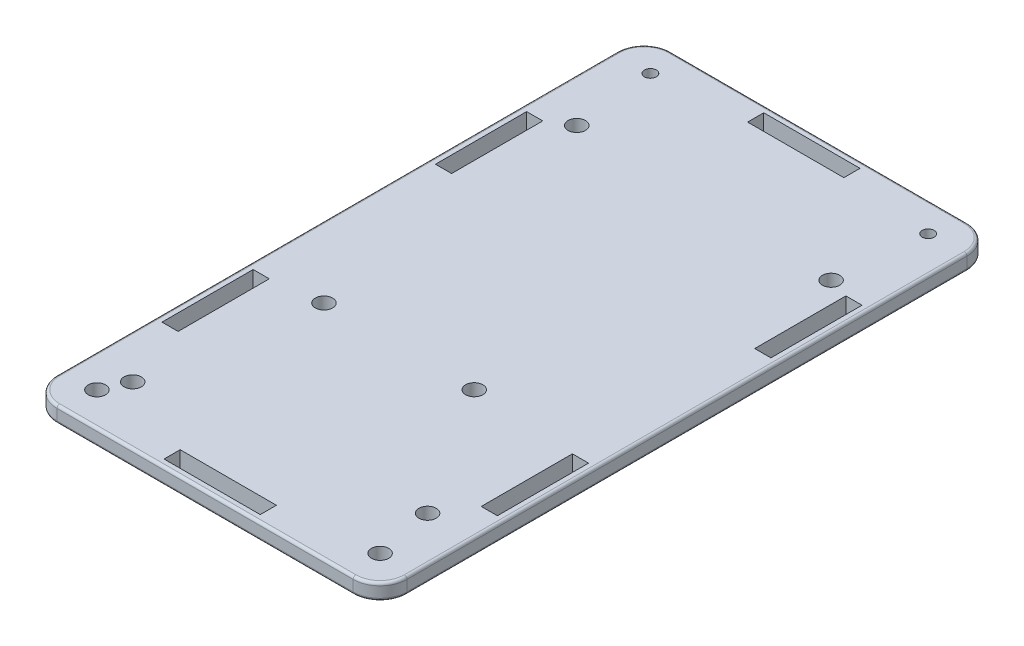
from build123d import *

# Parameters (mm, degrees)
BOSS_EXTRUDE3_DEPTH       = 3
SKETCH2_R                 = 1.608
CUT_EXTRUDE3_DEPTH        = 3
SKETCH7_R                 = 1.608
CUT_EXTRUDE8_DEPTH        = 3
SKETCH8_R                 = 1.608
CUT_EXTRUDE9_DEPTH        = 3
SKETCH9_R                 = 1.608
CUT_EXTRUDE11_DEPTH       = 3
SKETCH10_W                = 17.87
SKETCH10_H                = 3
SKETCH10_W_2              = 3
SKETCH10_H_2              = 16.933
CUT_EXTRUDE14_DEPTH       = 3
MIRROR4_COPY_1_SKETCH_W   = 17.87
MIRROR4_COPY_1_SKETCH_H   = 3
MIRROR4_COPY_1_SKETCH_W_2 = 3
MIRROR4_COPY_1_SKETCH_H_2 = 16.933
MIRROR4_COPY_1_DEPTH      = 3
SKETCH11_R                = 1.608
CUT_EXTRUDE15_DEPTH       = 3
FILLET1_R                 = 0.5
FILLET2_R                 = 0.5
SKETCH12_R                = 1.108
CUT_EXTRUDE16_DEPTH       = 3


with BuildPart() as part:
    # Sketch1 → Boss-Extrude3 (new body)
    with BuildSketch(Plane(origin=(0, 0, 0), x_dir=(1, 0, 0), z_dir=(0, 1, 0))):
        with BuildLine():
            Line((-32.5, -47), (-32.5, -52))
            ThreePointArc((-32.5, -52), (-31.035533906, -55.535533906), (-27.5, -57))
            Line((-27.5, -57), (-22.5, -57))
            Line((-22.5, -57), (22.5, -57))
            Line((22.5, -57), (27.5, -57))
            ThreePointArc((27.5, -57), (31.035533906, -55.535533906), (32.5, -52))
            Line((32.5, -52), (32.5, -47))
            Line((32.5, -47), (32.5, 47))
            Line((32.5, 47), (32.5, 52))
            ThreePointArc((32.5, 52), (31.035533906, 55.535533906), (27.5, 57))
            Line((27.5, 57), (22.5, 57))
            Line((22.5, 57), (-22.5, 57))
            Line((-22.5, 57), (-27.5, 57))
            ThreePointArc((-27.5, 57), (-31.035533906, 55.535533906), (-32.5, 52))
            Line((-32.5, 52), (-32.5, 47))
            Line((-32.5, 47), (-32.5, -47))
        make_face()
    extrude(amount=BOSS_EXTRUDE3_DEPTH)

    # Sketch2 → Cut-Extrude3 (cut)
    with BuildSketch(Plane(origin=(0, 3, 0), x_dir=(1, 0, 0), z_dir=(0, 1, 0))):
        with Locations(Location((24.261, 35.015, 0), (0, 0, 270))):
            Circle(SKETCH2_R)
    extrude(amount=-CUT_EXTRUDE3_DEPTH, mode=Mode.SUBTRACT)

    # Sketch7 → Cut-Extrude8 (cut)
    with BuildSketch(Plane.XZ):
        with Locations(Location((24.261, 39.945, 0), (0, 0, 270))):
            Circle(SKETCH7_R)
    extrude(amount=-CUT_EXTRUDE8_DEPTH, mode=Mode.SUBTRACT)

    # Sketch8 → Cut-Extrude9 (cut)
    with BuildSketch(Plane.XZ):
        with Locations(Location((-24.261, -36.285, 0), (0, 0, 270))):
            Circle(SKETCH8_R)
    extrude(amount=-CUT_EXTRUDE9_DEPTH, mode=Mode.SUBTRACT)

    # Sketch9 → Cut-Extrude11 (cut)
    with BuildSketch(Plane.XZ):
        with Locations(Location((-19.183, 15.745, 0), (0, 0, 270))):
            Circle(SKETCH9_R)
        with Locations(Location((8.725999982, 15.746, 0), (0, 0, 270))):
            Circle(SKETCH9_R)
        with Locations(Location((-24.261, 46.193, 0), (0, 0, 270))):
            Circle(SKETCH9_R)
    extrude(amount=-CUT_EXTRUDE11_DEPTH, mode=Mode.SUBTRACT)

    # Sketch10 → Cut-Extrude14 (cut)
    with BuildSketch(Plane(origin=(0, 3, 0), x_dir=(1, 0, 0), z_dir=(0, 1, 0))):
        with Locations((-0.005, -54.2)):
            Rectangle(SKETCH10_W, SKETCH10_H)
        with Locations((29.65, -25.3995)):
            Rectangle(SKETCH10_W_2, SKETCH10_H_2)
    cut_extrude14 = extrude(amount=-CUT_EXTRUDE14_DEPTH, mode=Mode.SUBTRACT)

    # Mirror3: Cut-Extrude14 across plane
    add(cut_extrude14.mirror(Plane.XY), mode=Mode.SUBTRACT)

    # Mirror4: Cut-Extrude14 across plane
    add(cut_extrude14.mirror(Plane(origin=(0, 0, 0), x_dir=(0, 0, 1), z_dir=(1, 0, 0))), mode=Mode.SUBTRACT)

    # Mirror4 copy 1 sketch → Mirror4 copy 1 (cut)
    with BuildSketch(Plane(origin=(0, 3, 0), x_dir=(-1, 0, 0), z_dir=(0, 1, 0))):
        with Locations((-0.005, -54.2)):
            Rectangle(MIRROR4_COPY_1_SKETCH_W, MIRROR4_COPY_1_SKETCH_H)
        with Locations((29.65, -25.3995)):
            Rectangle(MIRROR4_COPY_1_SKETCH_W_2, MIRROR4_COPY_1_SKETCH_H_2)
    extrude(amount=-MIRROR4_COPY_1_DEPTH, mode=Mode.SUBTRACT)

    # Sketch11 → Cut-Extrude15 (cut)
    with BuildSketch(Plane(origin=(0, 3, 0), x_dir=(1, 0, 0), z_dir=(0, 1, 0))):
        with Locations(Location((-26.3, -50.8, 0), (0, 0, 270))):
            Circle(SKETCH11_R)
    cut_extrude15 = extrude(amount=-CUT_EXTRUDE15_DEPTH, mode=Mode.SUBTRACT)

    # Mirror5: Cut-Extrude15 across plane
    add(cut_extrude15.mirror(Plane(origin=(0, 0, 0), x_dir=(0, 0, 1), z_dir=(1, 0, 0))), mode=Mode.SUBTRACT)

    # Fillet1
    fillet1_edges = [part.edges().sort_by_distance(p)[0] for p in [
        (0, 0, -57),
        (31.035533906, 0, -55.535533906),
        (32.5, 0, 0),
        (31.035533906, 0, 55.535533906),
        (0, 0, 57),
        (-31.035533906, 0, 55.535533906),
        (-32.5, 0, 0),
        (-31.035533906, 0, -55.535533906),
    ]]
    fillet(fillet1_edges, radius=FILLET1_R)

    # Fillet2
    fillet2_edges = [part.edges().sort_by_distance(p)[0] for p in [
        (-32.5, 3, 0),
        (-31.035533906, 3, 55.535533906),
        (0, 3, 57),
        (31.035533906, 3, 55.535533906),
        (32.5, 3, 0),
        (0, 3, -57),
        (31.035533906, 3, -55.535533906),
        (-31.035533906, 3, -55.535533906),
    ]]
    fillet(fillet2_edges, radius=FILLET2_R)

    # Sketch12 → Cut-Extrude16 (cut)
    with BuildSketch(Plane(origin=(0, 3, 0), x_dir=(1, 0, 0), z_dir=(0, 1, 0))):
        with Locations(Location((25.8, 51.5, 0), (0, 0, 270))):
            Circle(SKETCH12_R)
    cut_extrude16 = extrude(amount=-CUT_EXTRUDE16_DEPTH, mode=Mode.SUBTRACT)

    # Mirror8: Cut-Extrude16 across plane
    add(cut_extrude16.mirror(Plane(origin=(0, 0, 0), x_dir=(0, 0, 1), z_dir=(1, 0, 0))), mode=Mode.SUBTRACT)


solid = part.part
